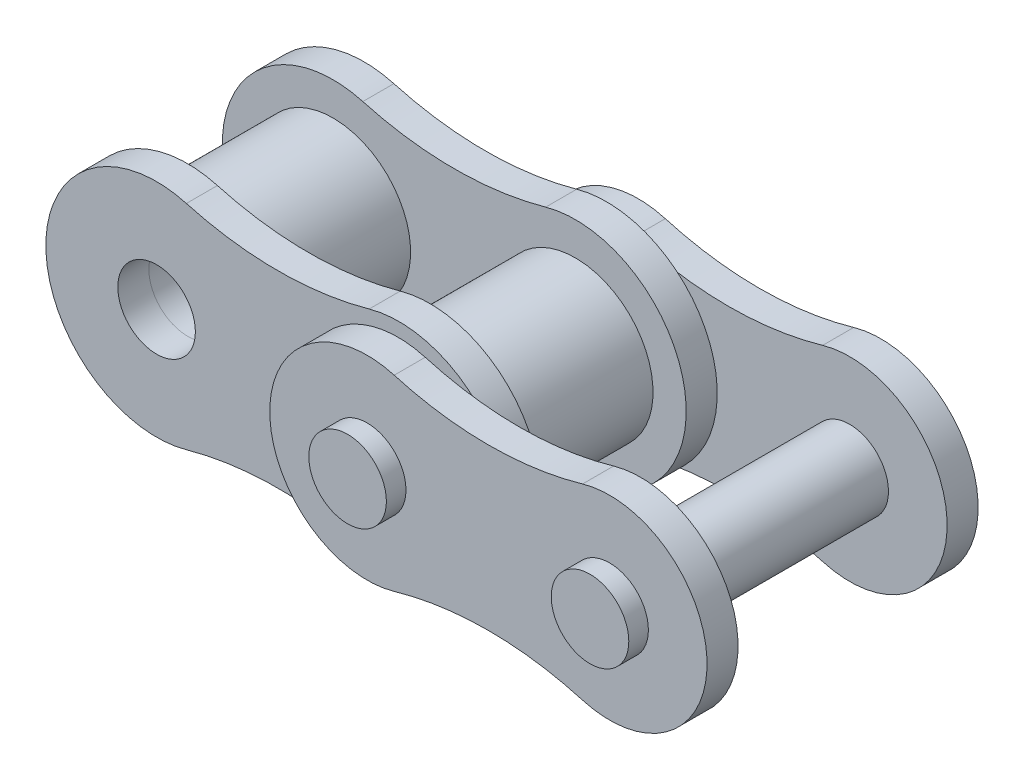
from build123d import *

# Parameters (mm, degrees)
SKETCH4_R                  = 5.08
SKETCH4_R_2                = 2.5654
BOSS_EXTRUDE1_DEPTH        = 4.7625
BOSS_EXTRUDE1_2_DEPTH      = 4.7625
SKETCH5_R                  = 2.54
BOSS_EXTRUDE2_DEPTH        = 2.032
LPATTERN1_COUNT            = 2
LPATTERN1_PITCH            = 15.875
SKETCH7_R                  = 2.54
BOSS_EXTRUDE3_DEPTH        = 2.032
BOSS_EXTRUDE4_DEPTH        = 10.16
BOSS_EXTRUDE4_DEPTH_BACK   = 10.16
SKETCH8_R                  = 2.54
BOSS_EXTRUDE4_2_DEPTH      = 10.16
BOSS_EXTRUDE4_2_DEPTH_BACK = 10.16


with BuildPart() as part:
    # Sketch4 → Boss-Extrude1 (new, symmetric)
    with BuildSketch(Plane.XY):
        with Locations(Location((-7.9375, 0, 0), (0, 0, 180))):
            Circle(SKETCH4_R)
        with Locations(Location((-7.9375, 0, 0), (0, 0, 180))):
            Circle(SKETCH4_R_2, mode=Mode.SUBTRACT)
    extrude(amount=BOSS_EXTRUDE1_DEPTH, both=True)


with BuildPart() as body_2:
    # Sketch4 → Boss-Extrude1 2 (new, symmetric)
    with BuildSketch(Plane.XY):
        with Locations(Location((7.9375, 0, 0), (0, 0, 180))):
            Circle(SKETCH4_R)
        with Locations(Location((7.9375, 0, 0), (0, 0, 180))):
            Circle(SKETCH4_R_2, mode=Mode.SUBTRACT)
    extrude(amount=BOSS_EXTRUDE1_2_DEPTH, both=True)


with BuildPart() as body_3:
    # Sketch5 → Boss-Extrude2 (new body)
    with BuildSketch(Plane.XY.offset(4.7625)):
        with BuildLine():
            ThreePointArc((-5.986592041, 6.984347573), (-15.1892, 0), (-5.986592041, -6.984347573))
            ThreePointArc((-5.986592041, -6.984347573), (0, -6.163945), (5.986592041, -6.984347573))
            ThreePointArc((5.986592041, -6.984347573), (15.1892, 0), (5.986592041, 6.984347573))
            ThreePointArc((5.986592041, 6.984347573), (0, 6.163945), (-5.986592041, 6.984347573))
        make_face()
        with Locations((-7.9375, 0)):
            Circle(SKETCH5_R, mode=Mode.SUBTRACT)
        with Locations((7.9375, 0)):
            Circle(SKETCH5_R, mode=Mode.SUBTRACT)
    extrude(amount=BOSS_EXTRUDE2_DEPTH)


with BuildPart() as lpattern1_1:
    # LPattern1: pattern copy
    add(body_2.part.moved(Location(Vector(1, 0, 0) * (1 * LPATTERN1_PITCH))))


with BuildPart() as body_5:
    # Sketch7 → Boss-Extrude3 (new body)
    with BuildSketch(Plane.XY.offset(-6.8453)):
        with BuildLine():
            ThreePointArc((9.706473173, 6.131412978), (1.556004, 0), (9.706473173, -6.131412978))
            ThreePointArc((9.706473173, -6.131412978), (15.875, -5.259356889), (22.043526827, -6.131412978))
            ThreePointArc((22.043526827, -6.131412978), (30.193996, 0), (22.043526827, 6.131412978))
            ThreePointArc((22.043526827, 6.131412978), (15.875, 5.259356889), (9.706473173, 6.131412978))
        make_face()
        with Locations((7.9375, 0)):
            Circle(SKETCH7_R, mode=Mode.SUBTRACT)
        with Locations((23.8125, 0)):
            Circle(SKETCH7_R, mode=Mode.SUBTRACT)
    extrude(amount=-BOSS_EXTRUDE3_DEPTH)


with BuildPart() as body_6:
    # Mirror1: mirrored copy
    add(body_3.part.mirror(Plane.XY))


with BuildPart() as body_7:
    # Mirror1 2: mirrored copy
    add(body_5.part.mirror(Plane.XY))


with BuildPart() as body_8:
    # Sketch8 → Boss-Extrude4 (new, two sides: drawn at the far end of the back side and taken through both)
    with BuildSketch(Plane.XY.offset(-BOSS_EXTRUDE4_DEPTH_BACK)):
        with Locations((7.9375, 0)):
            Circle(SKETCH8_R)
    extrude(amount=BOSS_EXTRUDE4_DEPTH + BOSS_EXTRUDE4_DEPTH_BACK)


with BuildPart() as body_9:
    # Sketch8 → Boss-Extrude4 2 (new, two sides: drawn at the far end of the back side and taken through both)
    with BuildSketch(Plane.XY.offset(-BOSS_EXTRUDE4_2_DEPTH_BACK)):
        with Locations((23.8125, 0)):
            Circle(SKETCH8_R)
    extrude(amount=BOSS_EXTRUDE4_2_DEPTH + BOSS_EXTRUDE4_2_DEPTH_BACK)


solid = Compound([part.part, body_2.part, body_3.part, body_5.part, body_6.part, body_7.part, body_8.part, body_9.part])
